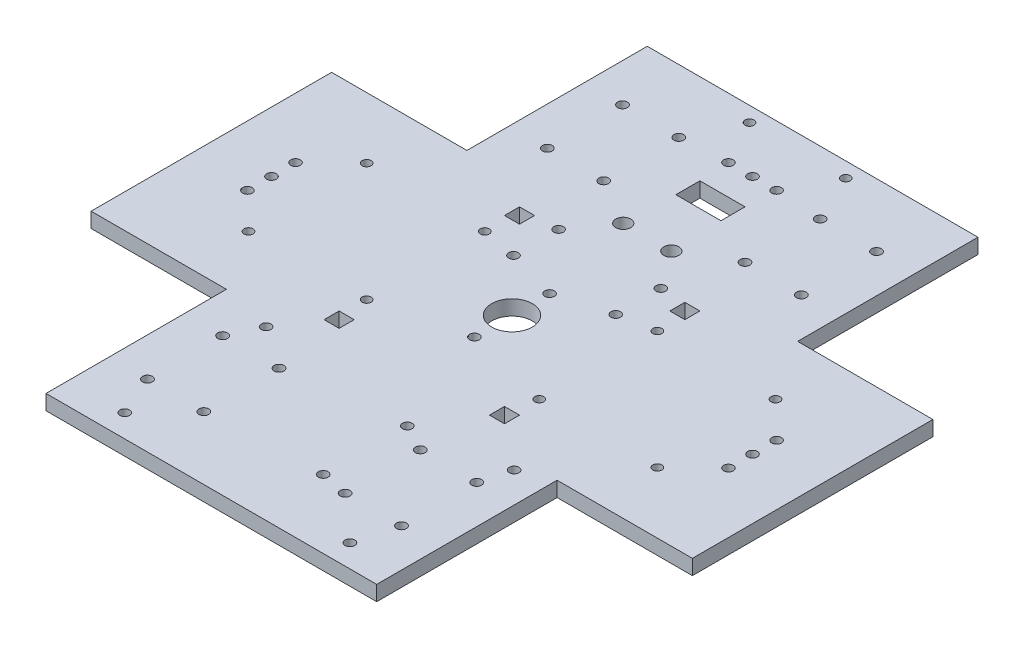
from build123d import *

# Parameters (mm, degrees)
SKETCH1_W           = 110
SKETCH1_H           = 200
BOSS_EXTRUDE1_DEPTH = 5
CUT_EXTRUDE1_REACH  = 116.237
SKETCH2_R           = 1.625
CUT_EXTRUDE3_REACH  = 116.237
SKETCH7_R           = 1.6
SKETCH9_W           = 200
SKETCH9_H           = 80
BOSS_EXTRUDE2_DEPTH = 5
CUT_EXTRUDE4_REACH  = 143.51
SKETCH10_R          = 1.5
CUT_EXTRUDE5_REACH  = 143.51
SKETCH11_W          = 5
SKETCH11_H          = 5
SKETCH12_R          = 1.6
CUT_EXTRUDE6_DEPTH  = 5
SKETCH13_R          = 6.75
CUT_EXTRUDE7_DEPTH  = 5
CUT_EXTRUDE8_REACH  = 143.51
SKETCH14_R          = 2.5
CUT_EXTRUDE9_REACH  = 143.51
SKETCH15_R          = 1.6
CUT_EXTRUDE10_REACH = 143.51
SKETCH16_R          = 1.5
CUT_EXTRUDE11_REACH = 143.51
SKETCH17_W          = 15
SKETCH17_H          = 8
CUT_EXTRUDE12_REACH = 143.51
SKETCH18_R          = 1.6


with BuildPart() as part:
    # Sketch1 → Boss-Extrude1 (new body)
    with BuildSketch(Plane(origin=(0, 0, 0), x_dir=(1, 0, 0), z_dir=(0, 1, 0))):
        Rectangle(SKETCH1_W, SKETCH1_H)
    extrude(amount=BOSS_EXTRUDE1_DEPTH)

    # Sketch2 → Cut-Extrude1 (cut, up to next)
    with BuildSketch(Plane(origin=(0, 5, 0), x_dir=(1, 0, 0), z_dir=(0, 1, 0)), mode=Mode.PRIVATE) as cut_extrude1_sk1:
        with Locations(Location((-23.5, 54, 0), (0, 0, 270))):
            Circle(SKETCH2_R)
    cut_extrude1_tool1 = extrude(cut_extrude1_sk1.sketch, amount=-CUT_EXTRUDE1_REACH, mode=Mode.PRIVATE) & part.part
    # Sketch2 → Cut-Extrude1 (cut, up to next)
    with BuildSketch(Plane(origin=(0, 5, 0), x_dir=(1, 0, 0), z_dir=(0, 1, 0)), mode=Mode.PRIVATE) as cut_extrude1_sk2:
        with Locations(Location((-23.5, 79, 0), (0, 0, 270))):
            Circle(SKETCH2_R)
    cut_extrude1_tool2 = extrude(cut_extrude1_sk2.sketch, amount=-CUT_EXTRUDE1_REACH, mode=Mode.PRIVATE) & part.part
    # Sketch2 → Cut-Extrude1 (cut, up to next)
    with BuildSketch(Plane(origin=(0, 5, 0), x_dir=(1, 0, 0), z_dir=(0, 1, 0)), mode=Mode.PRIVATE) as cut_extrude1_sk3:
        with Locations(Location((-42.25, 79, 0), (0, 0, 270))):
            Circle(SKETCH2_R)
    cut_extrude1_tool3 = extrude(cut_extrude1_sk3.sketch, amount=-CUT_EXTRUDE1_REACH, mode=Mode.PRIVATE) & part.part
    # Sketch2 → Cut-Extrude1 (cut, up to next)
    with BuildSketch(Plane(origin=(0, 5, 0), x_dir=(1, 0, 0), z_dir=(0, 1, 0)), mode=Mode.PRIVATE) as cut_extrude1_sk4:
        with Locations(Location((-42.25, 54, 0), (0, 0, 270))):
            Circle(SKETCH2_R)
    cut_extrude1_tool4 = extrude(cut_extrude1_sk4.sketch, amount=-CUT_EXTRUDE1_REACH, mode=Mode.PRIVATE) & part.part
    # Sketch2 → Cut-Extrude1 (cut, up to next)
    with BuildSketch(Plane(origin=(0, 5, 0), x_dir=(1, 0, 0), z_dir=(0, 1, 0)), mode=Mode.PRIVATE) as cut_extrude1_sk5:
        with Locations(Location((-23.5, -79, 0), (0, 0, 270))):
            Circle(SKETCH2_R)
    cut_extrude1_tool5 = extrude(cut_extrude1_sk5.sketch, amount=-CUT_EXTRUDE1_REACH, mode=Mode.PRIVATE) & part.part
    # Sketch2 → Cut-Extrude1 (cut, up to next)
    with BuildSketch(Plane(origin=(0, 5, 0), x_dir=(1, 0, 0), z_dir=(0, 1, 0)), mode=Mode.PRIVATE) as cut_extrude1_sk6:
        with Locations(Location((-23.5, -54, 0), (0, 0, 270))):
            Circle(SKETCH2_R)
    cut_extrude1_tool6 = extrude(cut_extrude1_sk6.sketch, amount=-CUT_EXTRUDE1_REACH, mode=Mode.PRIVATE) & part.part
    # Sketch2 → Cut-Extrude1 (cut, up to next)
    with BuildSketch(Plane(origin=(0, 5, 0), x_dir=(1, 0, 0), z_dir=(0, 1, 0)), mode=Mode.PRIVATE) as cut_extrude1_sk7:
        with Locations(Location((-42.25, -54, 0), (0, 0, 270))):
            Circle(SKETCH2_R)
    cut_extrude1_tool7 = extrude(cut_extrude1_sk7.sketch, amount=-CUT_EXTRUDE1_REACH, mode=Mode.PRIVATE) & part.part
    # Sketch2 → Cut-Extrude1 (cut, up to next)
    with BuildSketch(Plane(origin=(0, 5, 0), x_dir=(1, 0, 0), z_dir=(0, 1, 0)), mode=Mode.PRIVATE) as cut_extrude1_sk8:
        with Locations(Location((-42.25, -79, 0), (0, 0, 270))):
            Circle(SKETCH2_R)
    cut_extrude1_tool8 = extrude(cut_extrude1_sk8.sketch, amount=-CUT_EXTRUDE1_REACH, mode=Mode.PRIVATE) & part.part
    # Sketch2 → Cut-Extrude1 (cut, up to next)
    with BuildSketch(Plane(origin=(0, 5, 0), x_dir=(1, 0, 0), z_dir=(0, 1, 0)), mode=Mode.PRIVATE) as cut_extrude1_sk9:
        with Locations(Location((23.5, -79, 0), (0, 0, 270))):
            Circle(SKETCH2_R)
    cut_extrude1_tool9 = extrude(cut_extrude1_sk9.sketch, amount=-CUT_EXTRUDE1_REACH, mode=Mode.PRIVATE) & part.part
    # Sketch2 → Cut-Extrude1 (cut, up to next)
    with BuildSketch(Plane(origin=(0, 5, 0), x_dir=(1, 0, 0), z_dir=(0, 1, 0)), mode=Mode.PRIVATE) as cut_extrude1_sk10:
        with Locations(Location((23.5, -54, 0), (0, 0, 270))):
            Circle(SKETCH2_R)
    cut_extrude1_tool10 = extrude(cut_extrude1_sk10.sketch, amount=-CUT_EXTRUDE1_REACH, mode=Mode.PRIVATE) & part.part
    # Sketch2 → Cut-Extrude1 (cut, up to next)
    with BuildSketch(Plane(origin=(0, 5, 0), x_dir=(1, 0, 0), z_dir=(0, 1, 0)), mode=Mode.PRIVATE) as cut_extrude1_sk11:
        with Locations(Location((42.25, -54, 0), (0, 0, 270))):
            Circle(SKETCH2_R)
    cut_extrude1_tool11 = extrude(cut_extrude1_sk11.sketch, amount=-CUT_EXTRUDE1_REACH, mode=Mode.PRIVATE) & part.part
    # Sketch2 → Cut-Extrude1 (cut, up to next)
    with BuildSketch(Plane(origin=(0, 5, 0), x_dir=(1, 0, 0), z_dir=(0, 1, 0)), mode=Mode.PRIVATE) as cut_extrude1_sk12:
        with Locations(Location((42.25, -79, 0), (0, 0, 270))):
            Circle(SKETCH2_R)
    cut_extrude1_tool12 = extrude(cut_extrude1_sk12.sketch, amount=-CUT_EXTRUDE1_REACH, mode=Mode.PRIVATE) & part.part
    # Sketch2 → Cut-Extrude1 (cut, up to next)
    with BuildSketch(Plane(origin=(0, 5, 0), x_dir=(1, 0, 0), z_dir=(0, 1, 0)), mode=Mode.PRIVATE) as cut_extrude1_sk13:
        with Locations(Location((23.5, 54, 0), (0, 0, 270))):
            Circle(SKETCH2_R)
    cut_extrude1_tool13 = extrude(cut_extrude1_sk13.sketch, amount=-CUT_EXTRUDE1_REACH, mode=Mode.PRIVATE) & part.part
    # Sketch2 → Cut-Extrude1 (cut, up to next)
    with BuildSketch(Plane(origin=(0, 5, 0), x_dir=(1, 0, 0), z_dir=(0, 1, 0)), mode=Mode.PRIVATE) as cut_extrude1_sk14:
        with Locations(Location((23.5, 79, 0), (0, 0, 270))):
            Circle(SKETCH2_R)
    cut_extrude1_tool14 = extrude(cut_extrude1_sk14.sketch, amount=-CUT_EXTRUDE1_REACH, mode=Mode.PRIVATE) & part.part
    # Sketch2 → Cut-Extrude1 (cut, up to next)
    with BuildSketch(Plane(origin=(0, 5, 0), x_dir=(1, 0, 0), z_dir=(0, 1, 0)), mode=Mode.PRIVATE) as cut_extrude1_sk15:
        with Locations(Location((42.25, 79, 0), (0, 0, 270))):
            Circle(SKETCH2_R)
    cut_extrude1_tool15 = extrude(cut_extrude1_sk15.sketch, amount=-CUT_EXTRUDE1_REACH, mode=Mode.PRIVATE) & part.part
    # Sketch2 → Cut-Extrude1 (cut, up to next)
    with BuildSketch(Plane(origin=(0, 5, 0), x_dir=(1, 0, 0), z_dir=(0, 1, 0)), mode=Mode.PRIVATE) as cut_extrude1_sk16:
        with Locations(Location((42.25, 54, 0), (0, 0, 270))):
            Circle(SKETCH2_R)
    cut_extrude1_tool16 = extrude(cut_extrude1_sk16.sketch, amount=-CUT_EXTRUDE1_REACH, mode=Mode.PRIVATE) & part.part
    add(cut_extrude1_tool1.solids().sort_by_distance((-23.5, 5, -54))[0], mode=Mode.SUBTRACT)
    add(cut_extrude1_tool2.solids().sort_by_distance((-23.5, 5, -79))[0], mode=Mode.SUBTRACT)
    add(cut_extrude1_tool3.solids().sort_by_distance((-42.25, 5, -79))[0], mode=Mode.SUBTRACT)
    add(cut_extrude1_tool4.solids().sort_by_distance((-42.25, 5, -54))[0], mode=Mode.SUBTRACT)
    add(cut_extrude1_tool5.solids().sort_by_distance((-23.5, 5, 79))[0], mode=Mode.SUBTRACT)
    add(cut_extrude1_tool6.solids().sort_by_distance((-23.5, 5, 54))[0], mode=Mode.SUBTRACT)
    add(cut_extrude1_tool7.solids().sort_by_distance((-42.25, 5, 54))[0], mode=Mode.SUBTRACT)
    add(cut_extrude1_tool8.solids().sort_by_distance((-42.25, 5, 79))[0], mode=Mode.SUBTRACT)
    add(cut_extrude1_tool9.solids().sort_by_distance((23.5, 5, 79))[0], mode=Mode.SUBTRACT)
    add(cut_extrude1_tool10.solids().sort_by_distance((23.5, 5, 54))[0], mode=Mode.SUBTRACT)
    add(cut_extrude1_tool11.solids().sort_by_distance((42.25, 5, 54))[0], mode=Mode.SUBTRACT)
    add(cut_extrude1_tool12.solids().sort_by_distance((42.25, 5, 79))[0], mode=Mode.SUBTRACT)
    add(cut_extrude1_tool13.solids().sort_by_distance((23.5, 5, -54))[0], mode=Mode.SUBTRACT)
    add(cut_extrude1_tool14.solids().sort_by_distance((23.5, 5, -79))[0], mode=Mode.SUBTRACT)
    add(cut_extrude1_tool15.solids().sort_by_distance((42.25, 5, -79))[0], mode=Mode.SUBTRACT)
    add(cut_extrude1_tool16.solids().sort_by_distance((42.25, 5, -54))[0], mode=Mode.SUBTRACT)

    # Sketch7 → Cut-Extrude3 (cut, up to next)
    with BuildSketch(Plane(origin=(0, 5, 0), x_dir=(1, 0, 0), z_dir=(0, 1, 0)), mode=Mode.PRIVATE) as cut_extrude3_sk1:
        with Locations(Location((-37.6, -44.2, 0), (0, 0, 270))):
            Circle(SKETCH7_R)
    cut_extrude3_tool1 = extrude(cut_extrude3_sk1.sketch, amount=-CUT_EXTRUDE3_REACH, mode=Mode.PRIVATE) & part.part
    # Sketch7 → Cut-Extrude3 (cut, up to next)
    with BuildSketch(Plane(origin=(0, 5, 0), x_dir=(1, 0, 0), z_dir=(0, 1, 0)), mode=Mode.PRIVATE) as cut_extrude3_sk2:
        with Locations(Location((44.92, -44.2, 0), (0, 0, 270))):
            Circle(SKETCH7_R)
    cut_extrude3_tool2 = extrude(cut_extrude3_sk2.sketch, amount=-CUT_EXTRUDE3_REACH, mode=Mode.PRIVATE) & part.part
    # Sketch7 → Cut-Extrude3 (cut, up to next)
    with BuildSketch(Plane(origin=(0, 5, 0), x_dir=(1, 0, 0), z_dir=(0, 1, 0)), mode=Mode.PRIVATE) as cut_extrude3_sk3:
        with Locations(Location((14.47, -49.29, 0), (0, 0, 270))):
            Circle(SKETCH7_R)
    cut_extrude3_tool3 = extrude(cut_extrude3_sk3.sketch, amount=-CUT_EXTRUDE3_REACH, mode=Mode.PRIVATE) & part.part
    # Sketch7 → Cut-Extrude3 (cut, up to next)
    with BuildSketch(Plane(origin=(0, 5, 0), x_dir=(1, 0, 0), z_dir=(0, 1, 0)), mode=Mode.PRIVATE) as cut_extrude3_sk4:
        with Locations(Location((14.44, -77.22, 0), (0, 0, 270))):
            Circle(SKETCH7_R)
    cut_extrude3_tool4 = extrude(cut_extrude3_sk4.sketch, amount=-CUT_EXTRUDE3_REACH, mode=Mode.PRIVATE) & part.part
    # Sketch7 → Cut-Extrude3 (cut, up to next)
    with BuildSketch(Plane(origin=(0, 5, 0), x_dir=(1, 0, 0), z_dir=(0, 1, 0)), mode=Mode.PRIVATE) as cut_extrude3_sk5:
        with Locations(Location((-36.36, -92.46, 0), (0, 0, 270))):
            Circle(SKETCH7_R)
    cut_extrude3_tool5 = extrude(cut_extrude3_sk5.sketch, amount=-CUT_EXTRUDE3_REACH, mode=Mode.PRIVATE) & part.part
    # Sketch7 → Cut-Extrude3 (cut, up to next)
    with BuildSketch(Plane(origin=(0, 5, 0), x_dir=(1, 0, 0), z_dir=(0, 1, 0)), mode=Mode.PRIVATE) as cut_extrude3_sk6:
        with Locations(Location((38.57, -92.46, 0), (0, 0, 270))):
            Circle(SKETCH7_R)
    cut_extrude3_tool6 = extrude(cut_extrude3_sk6.sketch, amount=-CUT_EXTRUDE3_REACH, mode=Mode.PRIVATE) & part.part
    add(cut_extrude3_tool1.solids().sort_by_distance((-37.6, 5, 44.2))[0], mode=Mode.SUBTRACT)
    add(cut_extrude3_tool2.solids().sort_by_distance((44.92, 5, 44.2))[0], mode=Mode.SUBTRACT)
    add(cut_extrude3_tool3.solids().sort_by_distance((14.47, 5, 49.29))[0], mode=Mode.SUBTRACT)
    add(cut_extrude3_tool4.solids().sort_by_distance((14.44, 5, 77.22))[0], mode=Mode.SUBTRACT)
    add(cut_extrude3_tool5.solids().sort_by_distance((-36.36, 5, 92.46))[0], mode=Mode.SUBTRACT)
    add(cut_extrude3_tool6.solids().sort_by_distance((38.57, 5, 92.46))[0], mode=Mode.SUBTRACT)

    # Sketch9 → Boss-Extrude2 (add)
    with BuildSketch(Plane(origin=(0, 5, 0), x_dir=(1, 0, 0), z_dir=(0, 1, 0))):
        Rectangle(SKETCH9_W, SKETCH9_H)
    extrude(amount=-BOSS_EXTRUDE2_DEPTH)

    # Sketch10 → Cut-Extrude4 (cut, up to next)
    with BuildSketch(Plane(origin=(0, 5, 0), x_dir=(1, 0, 0), z_dir=(0, 1, 0)), mode=Mode.PRIVATE) as cut_extrude4_sk1:
        with Locations(Location((-68, 19.65, 0), (0, 0, 270))):
            Circle(SKETCH10_R)
    cut_extrude4_tool1 = extrude(cut_extrude4_sk1.sketch, amount=-CUT_EXTRUDE4_REACH, mode=Mode.PRIVATE) & part.part
    # Sketch10 → Cut-Extrude4 (cut, up to next)
    with BuildSketch(Plane(origin=(0, 5, 0), x_dir=(1, 0, 0), z_dir=(0, 1, 0)), mode=Mode.PRIVATE) as cut_extrude4_sk2:
        with Locations(Location((-28.7, 19.65, 0), (0, 0, 270))):
            Circle(SKETCH10_R)
    cut_extrude4_tool2 = extrude(cut_extrude4_sk2.sketch, amount=-CUT_EXTRUDE4_REACH, mode=Mode.PRIVATE) & part.part
    # Sketch10 → Cut-Extrude4 (cut, up to next)
    with BuildSketch(Plane(origin=(0, 5, 0), x_dir=(1, 0, 0), z_dir=(0, 1, 0)), mode=Mode.PRIVATE) as cut_extrude4_sk3:
        with Locations(Location((-28.7, -19.65, 0), (0, 0, 270))):
            Circle(SKETCH10_R)
    cut_extrude4_tool3 = extrude(cut_extrude4_sk3.sketch, amount=-CUT_EXTRUDE4_REACH, mode=Mode.PRIVATE) & part.part
    # Sketch10 → Cut-Extrude4 (cut, up to next)
    with BuildSketch(Plane(origin=(0, 5, 0), x_dir=(1, 0, 0), z_dir=(0, 1, 0)), mode=Mode.PRIVATE) as cut_extrude4_sk4:
        with Locations(Location((-68, -19.65, 0), (0, 0, 270))):
            Circle(SKETCH10_R)
    cut_extrude4_tool4 = extrude(cut_extrude4_sk4.sketch, amount=-CUT_EXTRUDE4_REACH, mode=Mode.PRIVATE) & part.part
    # Sketch10 → Cut-Extrude4 (cut, up to next)
    with BuildSketch(Plane(origin=(0, 5, 0), x_dir=(1, 0, 0), z_dir=(0, 1, 0)), mode=Mode.PRIVATE) as cut_extrude4_sk5:
        with Locations(Location((68, -19.65, 0), (0, 0, 270))):
            Circle(SKETCH10_R)
    cut_extrude4_tool5 = extrude(cut_extrude4_sk5.sketch, amount=-CUT_EXTRUDE4_REACH, mode=Mode.PRIVATE) & part.part
    # Sketch10 → Cut-Extrude4 (cut, up to next)
    with BuildSketch(Plane(origin=(0, 5, 0), x_dir=(1, 0, 0), z_dir=(0, 1, 0)), mode=Mode.PRIVATE) as cut_extrude4_sk6:
        with Locations(Location((28.7, -19.65, 0), (0, 0, 270))):
            Circle(SKETCH10_R)
    cut_extrude4_tool6 = extrude(cut_extrude4_sk6.sketch, amount=-CUT_EXTRUDE4_REACH, mode=Mode.PRIVATE) & part.part
    # Sketch10 → Cut-Extrude4 (cut, up to next)
    with BuildSketch(Plane(origin=(0, 5, 0), x_dir=(1, 0, 0), z_dir=(0, 1, 0)), mode=Mode.PRIVATE) as cut_extrude4_sk7:
        with Locations(Location((28.7, 19.65, 0), (0, 0, 270))):
            Circle(SKETCH10_R)
    cut_extrude4_tool7 = extrude(cut_extrude4_sk7.sketch, amount=-CUT_EXTRUDE4_REACH, mode=Mode.PRIVATE) & part.part
    # Sketch10 → Cut-Extrude4 (cut, up to next)
    with BuildSketch(Plane(origin=(0, 5, 0), x_dir=(1, 0, 0), z_dir=(0, 1, 0)), mode=Mode.PRIVATE) as cut_extrude4_sk8:
        with Locations(Location((68, 19.65, 0), (0, 0, 270))):
            Circle(SKETCH10_R)
    cut_extrude4_tool8 = extrude(cut_extrude4_sk8.sketch, amount=-CUT_EXTRUDE4_REACH, mode=Mode.PRIVATE) & part.part
    add(cut_extrude4_tool1.solids().sort_by_distance((-68, 5, -19.65))[0], mode=Mode.SUBTRACT)
    add(cut_extrude4_tool2.solids().sort_by_distance((-28.7, 5, -19.65))[0], mode=Mode.SUBTRACT)
    add(cut_extrude4_tool3.solids().sort_by_distance((-28.7, 5, 19.65))[0], mode=Mode.SUBTRACT)
    add(cut_extrude4_tool4.solids().sort_by_distance((-68, 5, 19.65))[0], mode=Mode.SUBTRACT)
    add(cut_extrude4_tool5.solids().sort_by_distance((68, 5, 19.65))[0], mode=Mode.SUBTRACT)
    add(cut_extrude4_tool6.solids().sort_by_distance((28.7, 5, 19.65))[0], mode=Mode.SUBTRACT)
    add(cut_extrude4_tool7.solids().sort_by_distance((28.7, 5, -19.65))[0], mode=Mode.SUBTRACT)
    add(cut_extrude4_tool8.solids().sort_by_distance((68, 5, -19.65))[0], mode=Mode.SUBTRACT)

    # Sketch11 → Cut-Extrude5 (cut, up to next)
    with BuildSketch(Plane(origin=(0, 5, 0), x_dir=(1, 0, 0), z_dir=(0, 1, 0)), mode=Mode.PRIVATE) as cut_extrude5_sk1:
        with Locations((-27.5, 30)):
            Rectangle(SKETCH11_W, SKETCH11_H)
    cut_extrude5_tool1 = extrude(cut_extrude5_sk1.sketch, amount=-CUT_EXTRUDE5_REACH, mode=Mode.PRIVATE) & part.part
    # Sketch11 → Cut-Extrude5 (cut, up to next)
    with BuildSketch(Plane(origin=(0, 5, 0), x_dir=(1, 0, 0), z_dir=(0, 1, 0)), mode=Mode.PRIVATE) as cut_extrude5_sk2:
        with Locations((-27.5, -30)):
            Rectangle(SKETCH11_W, SKETCH11_H)
    cut_extrude5_tool2 = extrude(cut_extrude5_sk2.sketch, amount=-CUT_EXTRUDE5_REACH, mode=Mode.PRIVATE) & part.part
    # Sketch11 → Cut-Extrude5 (cut, up to next)
    with BuildSketch(Plane(origin=(0, 5, 0), x_dir=(1, 0, 0), z_dir=(0, 1, 0)), mode=Mode.PRIVATE) as cut_extrude5_sk3:
        with Locations((27.5, -30)):
            Rectangle(SKETCH11_W, SKETCH11_H)
    cut_extrude5_tool3 = extrude(cut_extrude5_sk3.sketch, amount=-CUT_EXTRUDE5_REACH, mode=Mode.PRIVATE) & part.part
    # Sketch11 → Cut-Extrude5 (cut, up to next)
    with BuildSketch(Plane(origin=(0, 5, 0), x_dir=(1, 0, 0), z_dir=(0, 1, 0)), mode=Mode.PRIVATE) as cut_extrude5_sk4:
        with Locations((27.5, 30)):
            Rectangle(SKETCH11_W, SKETCH11_H)
    cut_extrude5_tool4 = extrude(cut_extrude5_sk4.sketch, amount=-CUT_EXTRUDE5_REACH, mode=Mode.PRIVATE) & part.part
    add(cut_extrude5_tool1.solids().sort_by_distance((-27.5, 5, -30))[0], mode=Mode.SUBTRACT)
    add(cut_extrude5_tool2.solids().sort_by_distance((-27.5, 5, 30))[0], mode=Mode.SUBTRACT)
    add(cut_extrude5_tool3.solids().sort_by_distance((27.5, 5, 30))[0], mode=Mode.SUBTRACT)
    add(cut_extrude5_tool4.solids().sort_by_distance((27.5, 5, -30))[0], mode=Mode.SUBTRACT)

    # Sketch12 → Cut-Extrude6 (cut)
    with BuildSketch(Plane.XZ):
        with Locations(Location((-17, -32.5, 0), (0, 0, 270))):
            Circle(SKETCH12_R)
        with Locations(Location((-17, -17.5, 0), (0, 0, 270))):
            Circle(SKETCH12_R)
        with Locations(Location((17, -17.5, 0), (0, 0, 270))):
            Circle(SKETCH12_R)
        with Locations(Location((17, -32.5, 0), (0, 0, 270))):
            Circle(SKETCH12_R)
    extrude(amount=-CUT_EXTRUDE6_DEPTH, mode=Mode.SUBTRACT)

    # Sketch13 → Cut-Extrude7 (cut)
    with BuildSketch(Plane.XZ):
        with Locations(Location((0, 0, 0), (0, 0, 270))):
            Circle(SKETCH13_R)
    extrude(amount=-CUT_EXTRUDE7_DEPTH, mode=Mode.SUBTRACT)

    # Sketch14 → Cut-Extrude8 (cut, up to next)
    with BuildSketch(Plane.XZ, mode=Mode.PRIVATE) as cut_extrude8_sk1:
        with Locations(Location((-8, -45, 0), (0, 0, 270))):
            Circle(SKETCH14_R)
    cut_extrude8_tool1 = extrude(cut_extrude8_sk1.sketch, amount=-CUT_EXTRUDE8_REACH, mode=Mode.PRIVATE) & part.part
    # Sketch14 → Cut-Extrude8 (cut, up to next)
    with BuildSketch(Plane.XZ, mode=Mode.PRIVATE) as cut_extrude8_sk2:
        with Locations(Location((8, -45, 0), (0, 0, 270))):
            Circle(SKETCH14_R)
    cut_extrude8_tool2 = extrude(cut_extrude8_sk2.sketch, amount=-CUT_EXTRUDE8_REACH, mode=Mode.PRIVATE) & part.part
    add(cut_extrude8_tool1.solids().sort_by_distance((-8, 0, -45))[0], mode=Mode.SUBTRACT)
    add(cut_extrude8_tool2.solids().sort_by_distance((8, 0, -45))[0], mode=Mode.SUBTRACT)

    # Sketch15 → Cut-Extrude9 (cut, up to next)
    with BuildSketch(Plane(origin=(0, 5, 0), x_dir=(1, 0, 0), z_dir=(0, 1, 0)), mode=Mode.PRIVATE) as cut_extrude9_sk1:
        with Locations(Location((0, 80, 0), (0, 0, 270))):
            Circle(SKETCH15_R)
    cut_extrude9_tool1 = extrude(cut_extrude9_sk1.sketch, amount=-CUT_EXTRUDE9_REACH, mode=Mode.PRIVATE) & part.part
    # Sketch15 → Cut-Extrude9 (cut, up to next)
    with BuildSketch(Plane(origin=(0, 5, 0), x_dir=(1, 0, 0), z_dir=(0, 1, 0)), mode=Mode.PRIVATE) as cut_extrude9_sk2:
        with Locations(Location((8, 80, 0), (0, 0, 270))):
            Circle(SKETCH15_R)
    cut_extrude9_tool2 = extrude(cut_extrude9_sk2.sketch, amount=-CUT_EXTRUDE9_REACH, mode=Mode.PRIVATE) & part.part
    # Sketch15 → Cut-Extrude9 (cut, up to next)
    with BuildSketch(Plane(origin=(0, 5, 0), x_dir=(1, 0, 0), z_dir=(0, 1, 0)), mode=Mode.PRIVATE) as cut_extrude9_sk3:
        with Locations(Location((-8, 80, 0), (0, 0, 270))):
            Circle(SKETCH15_R)
    cut_extrude9_tool3 = extrude(cut_extrude9_sk3.sketch, amount=-CUT_EXTRUDE9_REACH, mode=Mode.PRIVATE) & part.part
    # Sketch15 → Cut-Extrude9 (cut, up to next)
    with BuildSketch(Plane(origin=(0, 5, 0), x_dir=(1, 0, 0), z_dir=(0, 1, 0)), mode=Mode.PRIVATE) as cut_extrude9_sk4:
        with Locations(Location((80, 0, 0), (0, 0, 270))):
            Circle(SKETCH15_R)
    cut_extrude9_tool4 = extrude(cut_extrude9_sk4.sketch, amount=-CUT_EXTRUDE9_REACH, mode=Mode.PRIVATE) & part.part
    # Sketch15 → Cut-Extrude9 (cut, up to next)
    with BuildSketch(Plane(origin=(0, 5, 0), x_dir=(1, 0, 0), z_dir=(0, 1, 0)), mode=Mode.PRIVATE) as cut_extrude9_sk5:
        with Locations(Location((80, -8, 0), (0, 0, 270))):
            Circle(SKETCH15_R)
    cut_extrude9_tool5 = extrude(cut_extrude9_sk5.sketch, amount=-CUT_EXTRUDE9_REACH, mode=Mode.PRIVATE) & part.part
    # Sketch15 → Cut-Extrude9 (cut, up to next)
    with BuildSketch(Plane(origin=(0, 5, 0), x_dir=(1, 0, 0), z_dir=(0, 1, 0)), mode=Mode.PRIVATE) as cut_extrude9_sk6:
        with Locations(Location((80, 8, 0), (0, 0, 270))):
            Circle(SKETCH15_R)
    cut_extrude9_tool6 = extrude(cut_extrude9_sk6.sketch, amount=-CUT_EXTRUDE9_REACH, mode=Mode.PRIVATE) & part.part
    # Sketch15 → Cut-Extrude9 (cut, up to next)
    with BuildSketch(Plane(origin=(0, 5, 0), x_dir=(1, 0, 0), z_dir=(0, 1, 0)), mode=Mode.PRIVATE) as cut_extrude9_sk7:
        with Locations(Location((-80, 0, 0), (0, 0, 270))):
            Circle(SKETCH15_R)
    cut_extrude9_tool7 = extrude(cut_extrude9_sk7.sketch, amount=-CUT_EXTRUDE9_REACH, mode=Mode.PRIVATE) & part.part
    # Sketch15 → Cut-Extrude9 (cut, up to next)
    with BuildSketch(Plane(origin=(0, 5, 0), x_dir=(1, 0, 0), z_dir=(0, 1, 0)), mode=Mode.PRIVATE) as cut_extrude9_sk8:
        with Locations(Location((-80, 8, 0), (0, 0, 270))):
            Circle(SKETCH15_R)
    cut_extrude9_tool8 = extrude(cut_extrude9_sk8.sketch, amount=-CUT_EXTRUDE9_REACH, mode=Mode.PRIVATE) & part.part
    # Sketch15 → Cut-Extrude9 (cut, up to next)
    with BuildSketch(Plane(origin=(0, 5, 0), x_dir=(1, 0, 0), z_dir=(0, 1, 0)), mode=Mode.PRIVATE) as cut_extrude9_sk9:
        with Locations(Location((-80, -8, 0), (0, 0, 270))):
            Circle(SKETCH15_R)
    cut_extrude9_tool9 = extrude(cut_extrude9_sk9.sketch, amount=-CUT_EXTRUDE9_REACH, mode=Mode.PRIVATE) & part.part
    add(cut_extrude9_tool1.solids().sort_by_distance((0, 5, -80))[0], mode=Mode.SUBTRACT)
    add(cut_extrude9_tool2.solids().sort_by_distance((8, 5, -80))[0], mode=Mode.SUBTRACT)
    add(cut_extrude9_tool3.solids().sort_by_distance((-8, 5, -80))[0], mode=Mode.SUBTRACT)
    add(cut_extrude9_tool4.solids().sort_by_distance((80, 5, 0))[0], mode=Mode.SUBTRACT)
    add(cut_extrude9_tool5.solids().sort_by_distance((80, 5, 8))[0], mode=Mode.SUBTRACT)
    add(cut_extrude9_tool6.solids().sort_by_distance((80, 5, -8))[0], mode=Mode.SUBTRACT)
    add(cut_extrude9_tool7.solids().sort_by_distance((-80, 5, 0))[0], mode=Mode.SUBTRACT)
    add(cut_extrude9_tool8.solids().sort_by_distance((-80, 5, -8))[0], mode=Mode.SUBTRACT)
    add(cut_extrude9_tool9.solids().sort_by_distance((-80, 5, 8))[0], mode=Mode.SUBTRACT)

    # Sketch16 → Cut-Extrude10 (cut, up to next)
    with BuildSketch(Plane(origin=(0, 5, 0), x_dir=(1, 0, 0), z_dir=(0, 1, 0)), mode=Mode.PRIVATE) as cut_extrude10_sk1:
        with Locations(Location((-16, 95, 0), (0, 0, 270))):
            Circle(SKETCH16_R)
    cut_extrude10_tool1 = extrude(cut_extrude10_sk1.sketch, amount=-CUT_EXTRUDE10_REACH, mode=Mode.PRIVATE) & part.part
    # Sketch16 → Cut-Extrude10 (cut, up to next)
    with BuildSketch(Plane(origin=(0, 5, 0), x_dir=(1, 0, 0), z_dir=(0, 1, 0)), mode=Mode.PRIVATE) as cut_extrude10_sk2:
        with Locations(Location((16, 95, 0), (0, 0, 270))):
            Circle(SKETCH16_R)
    cut_extrude10_tool2 = extrude(cut_extrude10_sk2.sketch, amount=-CUT_EXTRUDE10_REACH, mode=Mode.PRIVATE) & part.part
    add(cut_extrude10_tool1.solids().sort_by_distance((-16, 5, -95))[0], mode=Mode.SUBTRACT)
    add(cut_extrude10_tool2.solids().sort_by_distance((16, 5, -95))[0], mode=Mode.SUBTRACT)

    # Sketch17 → Cut-Extrude11 (cut, up to next)
    with BuildSketch(Plane(origin=(0, 5, 0), x_dir=(1, 0, 0), z_dir=(0, 1, 0)), mode=Mode.PRIVATE) as cut_extrude11_sk1:
        with Locations((0, 66)):
            Rectangle(SKETCH17_W, SKETCH17_H)
    cut_extrude11_tool1 = extrude(cut_extrude11_sk1.sketch, amount=-CUT_EXTRUDE11_REACH, mode=Mode.PRIVATE) & part.part
    add(cut_extrude11_tool1.solids().sort_by_distance((0, 5, -66))[0], mode=Mode.SUBTRACT)

    # Sketch18 → Cut-Extrude12 (cut, up to next)
    with BuildSketch(Plane(origin=(0, 5, 0), x_dir=(1, 0, 0), z_dir=(0, 1, 0)), mode=Mode.PRIVATE) as cut_extrude12_sk1:
        with Locations(Location((0, 12.5, 0), (0, 0, 270))):
            Circle(SKETCH18_R)
    cut_extrude12_tool1 = extrude(cut_extrude12_sk1.sketch, amount=-CUT_EXTRUDE12_REACH, mode=Mode.PRIVATE) & part.part
    # Sketch18 → Cut-Extrude12 (cut, up to next)
    with BuildSketch(Plane(origin=(0, 5, 0), x_dir=(1, 0, 0), z_dir=(0, 1, 0)), mode=Mode.PRIVATE) as cut_extrude12_sk2:
        with Locations(Location((0, -12.5, 0), (0, 0, 270))):
            Circle(SKETCH18_R)
    cut_extrude12_tool2 = extrude(cut_extrude12_sk2.sketch, amount=-CUT_EXTRUDE12_REACH, mode=Mode.PRIVATE) & part.part
    add(cut_extrude12_tool1.solids().sort_by_distance((0, 5, -12.5))[0], mode=Mode.SUBTRACT)
    add(cut_extrude12_tool2.solids().sort_by_distance((0, 5, 12.5))[0], mode=Mode.SUBTRACT)


solid = part.part
